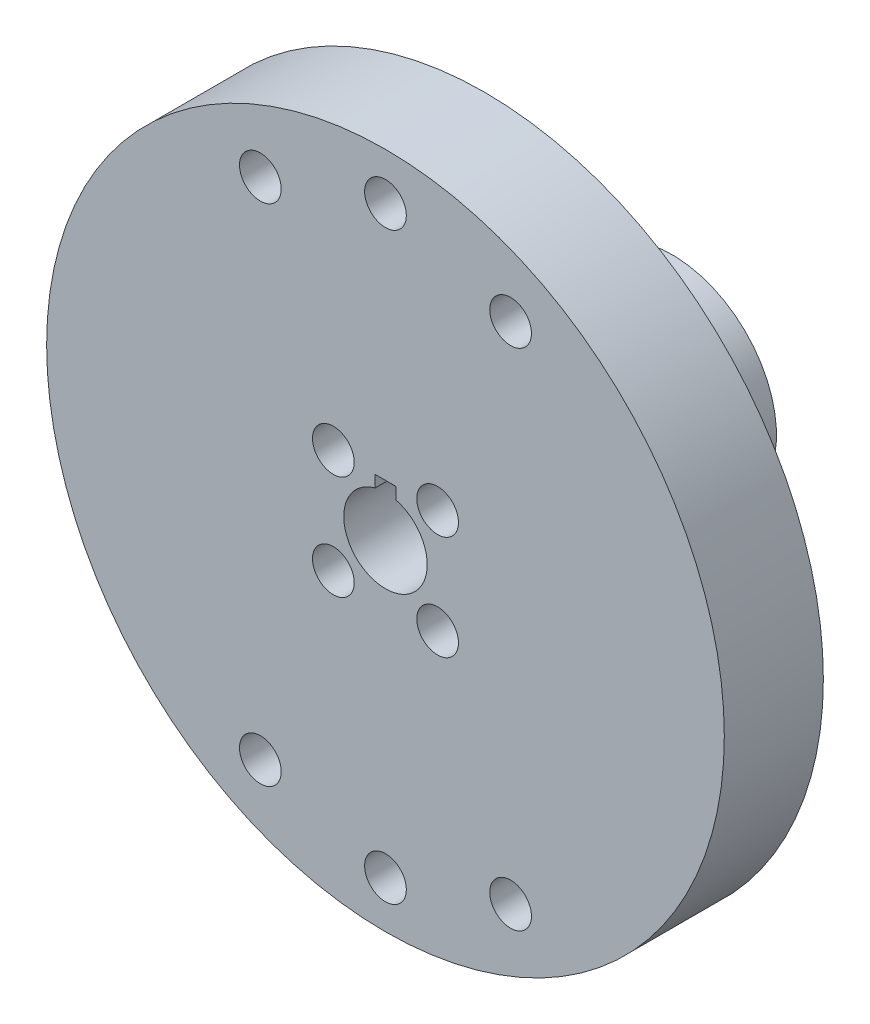
from build123d import *

# Parameters (mm, degrees)
SKETCH1_R             = 32.5
SKETCH1_R_2           = 2
BOSS_EXTRUDE1_DEPTH   = 9.5
CUT_EXTRUDE1_DEPTH    = 3.5
BOSS_EXTRUDE2_START   = 4
SKETCH4_R             = 17.5
BOSS_EXTRUDE2_DEPTH   = 4
BOSS_EXTRUDE4_START   = 17.5
SKETCH5_R             = 10
BOSS_EXTRUDE4_DEPTH   = 17.5
SKETCH6_R             = 1.225
CUT_EXTRUDE2_DEPTH    = 20
F_4_0MM_DOWEL_HOLE1_D = 4
CIRPATTERN1_COUNT     = 4
FILLET1_R             = 1


with BuildPart() as part:
    # Sketch1 → Boss-Extrude1 (new body)
    with BuildSketch(Plane.XY):
        Circle(SKETCH1_R)
        with Locations((0, 28)):
            Circle(SKETCH1_R_2, mode=Mode.SUBTRACT)
        with Locations((12, 24.2)):
            Circle(SKETCH1_R_2, mode=Mode.SUBTRACT)
        with Locations((-12, 24.2)):
            Circle(SKETCH1_R_2, mode=Mode.SUBTRACT)
        with Locations((-12, -24.2)):
            Circle(SKETCH1_R_2, mode=Mode.SUBTRACT)
        with Locations((0, -28)):
            Circle(SKETCH1_R_2, mode=Mode.SUBTRACT)
        with Locations((12, -24.2)):
            Circle(SKETCH1_R_2, mode=Mode.SUBTRACT)
        with BuildLine():
            Line((-1, 3.872983346), (-1, 5.002983346))
            Line((-1, 5.002983346), (1, 5.002983346))
            Line((1, 5.002983346), (1, 3.872983346))
            ThreePointArc((1, 3.872983346), (0, -4), (-1, 3.872983346))
        make_face(mode=Mode.SUBTRACT)
    extrude(amount=BOSS_EXTRUDE1_DEPTH)

    # Sketch2 → Cut-Extrude1 (cut)
    with BuildSketch(Plane(origin=(0, 0, 0), x_dir=(-1, 0, 0), z_dir=(0, 0, -1))):
        with BuildLine():
            ThreePointArc((-14.609747332, 21.50709843), (-26, 0), (-14.609747332, -21.50709843))
            ThreePointArc((-14.609747332, -21.50709843), (-13.665935552, -27.559636697), (-8.276785753, -24.647409957))
            ThreePointArc((-8.276785753, -24.647409957), (-5.252947534, -25.463828114), (-2.152878353, -25.910714286))
            ThreePointArc((-2.152878353, -25.910714286), (0, -31), (2.152878353, -25.910714286))
            ThreePointArc((2.152878353, -25.910714286), (5.252947534, -25.463828114), (8.276785753, -24.647409957))
            ThreePointArc((8.276785753, -24.647409957), (13.665935552, -27.559636697), (14.609747332, -21.50709843))
            ThreePointArc((14.609747332, -21.50709843), (26, 0), (14.609747332, 21.50709843))
            ThreePointArc((14.609747332, 21.50709843), (13.665935552, 27.559636697), (8.276785753, 24.647409957))
            ThreePointArc((8.276785753, 24.647409957), (5.252947534, 25.463828114), (2.152878353, 25.910714286))
            ThreePointArc((2.152878353, 25.910714286), (0, 31), (-2.152878353, 25.910714286))
            ThreePointArc((-2.152878353, 25.910714286), (-5.252947534, 25.463828114), (-8.276785753, 24.647409957))
            ThreePointArc((-8.276785753, 24.647409957), (-13.665935552, 27.559636697), (-14.609747332, 21.50709843))
        make_face()
    extrude(amount=-CUT_EXTRUDE1_DEPTH, mode=Mode.SUBTRACT)

    # Sketch4 → Boss-Extrude2 (add)
    with BuildSketch(Plane(origin=(0, 0, 3.5), x_dir=(-1, 0, 0), z_dir=(0, 0, -1)).offset(BOSS_EXTRUDE2_START)):
        Circle(SKETCH4_R)
        with BuildLine():
            Line((1, 5.002983346), (1, 3.872983346))
            ThreePointArc((1, 3.872983346), (0, -4), (-1, 3.872983346))
            Line((-1, 3.872983346), (-1, 5.002983346))
            Line((-1, 5.002983346), (1, 5.002983346))
        make_face(mode=Mode.SUBTRACT)
    extrude(amount=-BOSS_EXTRUDE2_DEPTH)

    # Sketch5 → Boss-Extrude4 (add)
    with BuildSketch(Plane(origin=(0, 0, -0.5), x_dir=(-1, 0, 0), z_dir=(0, 0, -1)).offset(BOSS_EXTRUDE4_START)):
        Circle(SKETCH5_R)
        with BuildLine():
            Line((-1, 5.002983346), (-1, 3.872983346))
            ThreePointArc((-1, 3.872983346), (0, -4), (1, 3.872983346))
            Line((1, 3.872983346), (1, 5.002983346))
            Line((1, 5.002983346), (-1, 5.002983346))
        make_face(mode=Mode.SUBTRACT)
    extrude(amount=-BOSS_EXTRUDE4_DEPTH)

    # Sketch6 → Cut-Extrude2 (cut, symmetric)
    with BuildSketch(Plane(origin=(0, 0, 0), x_dir=(0, 0, -1), z_dir=(1, 0, 0))):
        with Locations((6.8, 0)):
            Circle(SKETCH6_R)
    extrude(amount=CUT_EXTRUDE2_DEPTH, both=True, mode=Mode.SUBTRACT)

    # Ø4.0mm Dowel Hole1 (through all)
    with Locations(Plane(origin=(0, 0, -18), x_dir=(-1, 0, 0), z_dir=(0, 0, -1))):
        with Locations((5, 5)):
            f_4_0mm_dowel_hole1 = Hole(F_4_0MM_DOWEL_HOLE1_D / 2)

    # CirPattern1: Ø4.0mm Dowel Hole1 ×4 about axis
    cirpattern1_axis = Axis((0, 0, 0), (0, 0, 1))
    for i in range(1, CIRPATTERN1_COUNT):
        add(f_4_0mm_dowel_hole1.rotate(cirpattern1_axis, i * 360 / CIRPATTERN1_COUNT), mode=Mode.SUBTRACT)

    # Fillet1
    fillet1_edges = [part.edges().sort_by_distance(p)[0] for p in [
        (10, 0, -0.5),
    ]]
    fillet(fillet1_edges, radius=FILLET1_R)


solid = part.part
